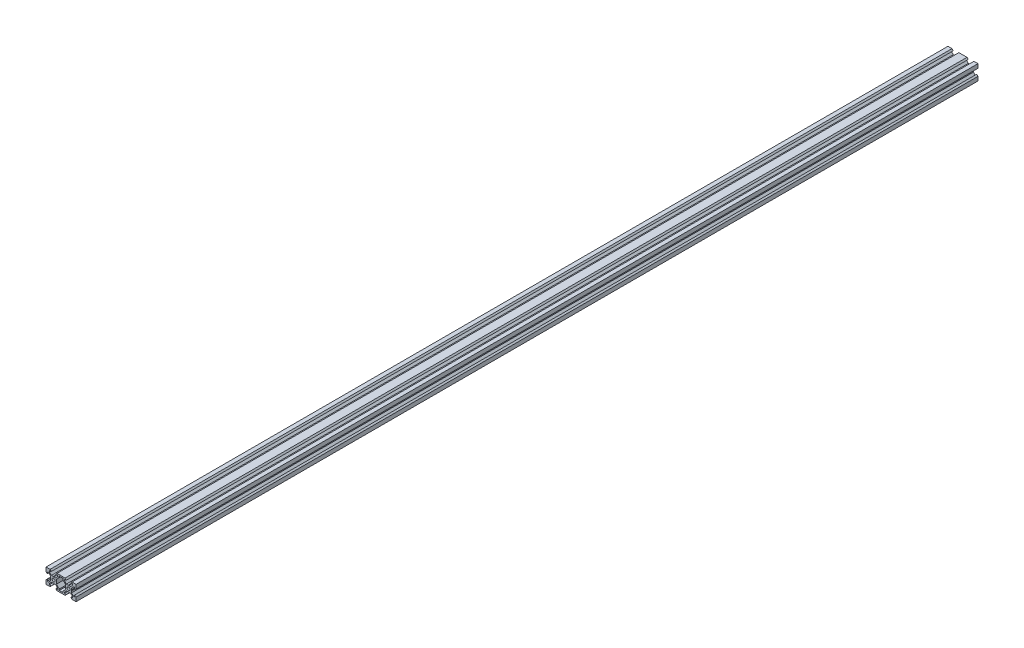
from build123d import *

# Parameters (mm, degrees)
SKETCH1_R           = 2
BOSS_EXTRUDE1_DEPTH = 1200


with BuildPart() as part:
    # Sketch1 → Boss-Extrude1 (new body)
    with BuildSketch(Plane.XY):
        Polygon((-5.389620664, 10), (5.389620664, 10), (6.9, 8.2), (4.5, 8.2), (4.5, 6.556171609), (7.151917065, 3.899773171), (9.480384758, 3.899773171), (10, 3.599773171), (10.519615242, 3.899773171), (12.848082935, 3.899773171), (15.5, 6.556171609), (15.5, 8.2), (13.1, 8.2), (14.610379336, 10), (20, 10), (20, 4.610379336), (18.2, 3.1), (18.2, 5.5), (16.556171609, 5.5), (13.9, 2.839339828), (13.9, 0.519615231), (13.599999981, 0), (13.9, -0.519615231), (13.9, -2.839339828), (16.556171609, -5.5), (18.2, -5.5), (18.2, -3.1), (20, -4.610379336), (20, -10), (14.610379336, -10), (13.1, -8.2), (15.5, -8.2), (15.5, -6.556171609), (12.839339828, -3.9), (10.519222362, -3.9), (10, -3.600226829), (9.480777638, -3.9), (7.160660172, -3.9), (4.5, -6.556171609), (4.5, -8.2), (6.9, -8.2), (5.389620664, -10), (-5.389620664, -10), (-6.9, -8.2), (-4.5, -8.2), (-4.5, -6.556171609), (-7.160432959, -3.900226829), (-9.480384758, -3.900226829), (-10, -3.600226829), (-10.519615242, -3.900226829), (-12.839339828, -3.9), (-15.5, -6.556171609), (-15.5, -8.2), (-13.1, -8.2), (-14.610379336, -10), (-20, -10), (-20, -4.610379336), (-18.2, -3.1), (-18.2, -5.5), (-16.556171609, -5.5), (-13.9, -2.839339828), (-13.9, -0.519615231), (-13.599999981, 0), (-13.9, 0.519615231), (-13.9, 2.839339828), (-16.556171609, 5.5), (-18.2, 5.5), (-18.2, 3.1), (-20, 4.610379336), (-20, 10), (-14.610379336, 10), (-13.1, 8.2), (-15.5, 8.2), (-15.5, 6.556171609), (-12.839339828, 3.9), (-10.519615242, 3.899773171), (-10, 3.599773171), (-9.480384758, 3.899773171), (-7.160660172, 3.9), (-4.5, 6.556171609), (-4.5, 8.2), (-6.9, 8.2), align=None)
        with Locations((-10, 0)):
            Circle(SKETCH1_R, mode=Mode.SUBTRACT)
        with Locations((10, 0)):
            Circle(SKETCH1_R, mode=Mode.SUBTRACT)
        Polygon((-6.1, -2.839339828), (-2.376887287, -6.556171609), (-2.376887287, -8.2), (2.376887287, -8.2), (2.376887287, -6.556171609), (6.1, -2.839339828), (6.1, 2.839339828), (2.383168219, 6.556171609), (2.383168219, 8.2), (-2.383168219, 8.2), (-2.383168219, 6.556171609), (-6.1, 2.839339828), align=None, mode=Mode.SUBTRACT)
    extrude(amount=BOSS_EXTRUDE1_DEPTH)


solid = part.part
